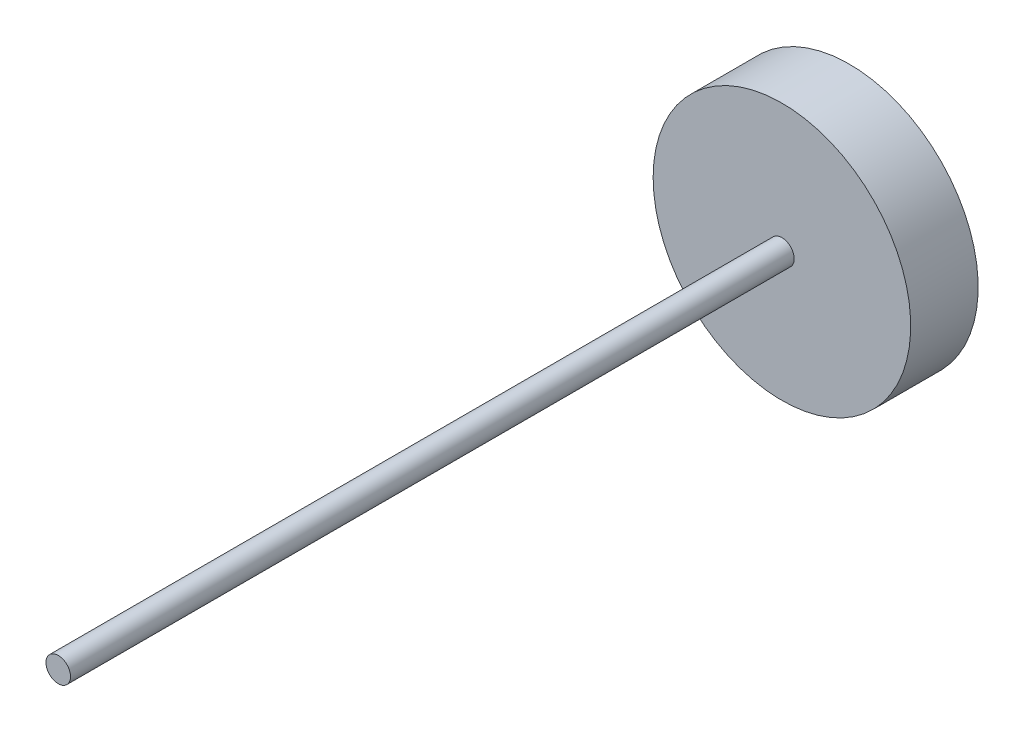
from build123d import *

# Parameters (mm, degrees)
SKETCH1_R                = 88
BOSS_EXTRUDE3_DEPTH      = 25
SKETCH4_W                = 10.4719
SKETCH4_H                = 13.351164338
BOSS_EXTRUDE4_DEPTH      = 25
FILLET2_R                = 4
CIRPATTERN1_COUNT        = 30
FILLET2_OF_CIRPATTERN1_R = 4
SKETCH6_R                = 10
BOSS_EXTRUDE5_DEPTH      = 60
BOSS_EXTRUDE6_START      = 10
SKETCH7_R                = 10
BOSS_EXTRUDE6_DEPTH      = 10
SKETCH8_R                = 10
BOSS_EXTRUDE7_DEPTH      = 10
SKETCH9_R                = 10
BOSS_EXTRUDE8_DEPTH      = 25
SKETCH10_R               = 10
BOSS_EXTRUDE9_DEPTH      = 42.5
SKETCH12_R               = 12.5
CUT_EXTRUDE1_DEPTH       = 12
CUT_EXTRUDE2_START       = -55.5
SKETCH13_R               = 10
CUT_EXTRUDE2_DEPTH       = 55.5
SKETCH14_R               = 10
BOSS_EXTRUDE10_DEPTH     = 440
SKETCH15_R               = 105
BOSS_EXTRUDE12_DEPTH     = 25
BOSS_EXTRUDE13_START     = 30
SKETCH16_R               = 105
BOSS_EXTRUDE13_DEPTH     = 30
SKETCH17_R               = 10
BOSS_EXTRUDE14_DEPTH     = 50
SKETCH18_R               = 10
BOSS_EXTRUDE15_DEPTH     = 30


with BuildPart() as part:
    # Sketch1 → Boss-Extrude3 (new body)
    with BuildSketch(Plane.XY):
        Circle(SKETCH1_R)
    extrude(amount=BOSS_EXTRUDE3_DEPTH)

    # Sketch4 → Boss-Extrude4 (add)
    with BuildSketch(Plane.XY.offset(25)):
        with Locations((0, 93.324417831)):
            Rectangle(SKETCH4_W, SKETCH4_H)
    boss_extrude4 = extrude(amount=-BOSS_EXTRUDE4_DEPTH)

    # Fillet2
    fillet2_edges = [part.edges().sort_by_distance(p)[0] for p in [
        (5.23595, 100, 12.5),
        (0, 100, 0),
        (-5.23595, 100, 12.5),
        (0, 100, 25),
    ]]
    fillet(fillet2_edges, radius=FILLET2_R)

    # CirPattern1: Boss-Extrude4 ×30 about axis
    cirpattern1_axis = Axis((0, 0.317667884, 0), (0, 0, 1))
    for i in range(1, CIRPATTERN1_COUNT):
        add(boss_extrude4.rotate(cirpattern1_axis, i * 360 / CIRPATTERN1_COUNT))

    # Fillet2 of CirPattern1
    fillet2_of_cirpattern1_edges = [part.edges().sort_by_distance(p)[0] for p in [
        (-15.603590285, 98.910317096, 12.5),
        (-20.725122215, 97.821701879, 0),
        (-25.846654145, 96.733086661, 12.5),
        (-20.725122215, 97.821701879, 25),
        (-35.7611788, 93.511662322, 12.5),
        (-40.544457139, 91.382009596, 0),
        (-45.327735478, 89.252356869, 12.5),
        (-40.544457139, 91.382009596, 25),
        (-54.3558322, 84.039982796, 12.5),
        (-58.591804732, 80.962368605, 0),
        (-62.827777264, 77.884754413, 12.5),
        (-58.591804732, 80.962368605, 25),
        (-70.574874905, 70.909236365, 12.5),
        (-74.078409304, 67.018167216, 0),
        (-77.581943702, 63.127098067, 12.5),
        (-74.078409304, 67.018167216, 25),
        (-83.709456921, 54.693299655, 12.5),
        (-86.327431921, 50.158833942, 0),
        (-88.945406921, 45.624368229, 12.5),
        (-86.327431921, 50.158833942, 25),
        (-93.185533987, 36.100886913, 12.5),
        (-94.803531519, 31.121202547, 0),
        (-96.42152905, 26.14151818, 12.5),
        (-94.803531519, 31.121202547, 25),
        (-98.588956064, 15.944575793, 12.5),
        (-99.136261871, 10.737308875, 0),
        (-99.683567678, 5.530041957, 12.5),
        (-99.136261871, 10.737308875, 25),
        (-99.683567678, -4.894706189, 12.5),
        (-99.136261871, -10.101973107, 0),
        (-98.588956064, -15.309240025, 12.5),
        (-99.136261871, -10.101973107, 25),
        (-96.42152905, -25.506182413, 12.5),
        (-94.803531519, -30.485866779, 0),
        (-93.185533987, -35.465551145, 12.5),
        (-94.803531519, -30.485866779, 25),
        (-88.945406921, -44.989032461, 12.5),
        (-86.327431921, -49.523498174, 0),
        (-83.709456921, -54.057963887, 12.5),
        (-86.327431921, -49.523498174, 25),
        (-77.581943702, -62.491762299, 12.5),
        (-74.078409304, -66.382831448, 0),
        (-70.574874905, -70.273900597, 12.5),
        (-74.078409304, -66.382831448, 25),
        (-62.827777264, -77.249418645, 12.5),
        (-58.591804732, -80.327032837, 0),
        (-54.3558322, -83.404647029, 12.5),
        (-58.591804732, -80.327032837, 25),
        (-45.327735478, -88.617021102, 12.5),
        (-40.544457139, -90.746673828, 0),
        (-35.7611788, -92.876326554, 12.5),
        (-40.544457139, -90.746673828, 25),
        (-25.846654145, -96.097750894, 12.5),
        (-20.725122215, -97.186366111, 0),
        (-15.603590285, -98.274981329, 12.5),
        (-20.725122215, -97.186366111, 25),
        (-5.23595, -99.364664232, 12.5),
        (0, -99.364664232, 0),
        (5.23595, -99.364664232, 12.5),
        (0, -99.364664232, 25),
        (15.603590285, -98.274981329, 12.5),
        (20.725122215, -97.186366111, 0),
        (25.846654145, -96.097750894, 12.5),
        (20.725122215, -97.186366111, 25),
        (35.7611788, -92.876326554, 12.5),
        (40.544457139, -90.746673828, 0),
        (45.327735478, -88.617021102, 12.5),
        (40.544457139, -90.746673828, 25),
        (54.3558322, -83.404647029, 12.5),
        (58.591804732, -80.327032837, 0),
        (62.827777264, -77.249418645, 12.5),
        (58.591804732, -80.327032837, 25),
        (70.574874905, -70.273900597, 12.5),
        (74.078409304, -66.382831448, 0),
        (77.581943702, -62.491762299, 12.5),
        (74.078409304, -66.382831448, 25),
        (83.709456921, -54.057963887, 12.5),
        (86.327431921, -49.523498174, 0),
        (88.945406921, -44.989032461, 12.5),
        (86.327431921, -49.523498174, 25),
        (93.185533987, -35.465551145, 12.5),
        (94.803531519, -30.485866779, 0),
        (96.42152905, -25.506182413, 12.5),
        (94.803531519, -30.485866779, 25),
        (98.588956064, -15.309240025, 12.5),
        (99.136261871, -10.101973107, 0),
        (99.683567678, -4.894706189, 12.5),
        (99.136261871, -10.101973107, 25),
        (99.683567678, 5.530041957, 12.5),
        (99.136261871, 10.737308875, 0),
        (98.588956064, 15.944575793, 12.5),
        (99.136261871, 10.737308875, 25),
        (96.42152905, 26.14151818, 12.5),
        (94.803531519, 31.121202547, 0),
        (93.185533987, 36.100886913, 12.5),
        (94.803531519, 31.121202547, 25),
        (88.945406921, 45.624368229, 12.5),
        (86.327431921, 50.158833942, 0),
        (83.709456921, 54.693299655, 12.5),
        (86.327431921, 50.158833942, 25),
        (77.581943702, 63.127098067, 12.5),
        (74.078409304, 67.018167216, 0),
        (70.574874905, 70.909236365, 12.5),
        (74.078409304, 67.018167216, 25),
        (62.827777264, 77.884754413, 12.5),
        (58.591804732, 80.962368605, 0),
        (54.3558322, 84.039982796, 12.5),
        (58.591804732, 80.962368605, 25),
        (45.327735478, 89.252356869, 12.5),
        (40.544457139, 91.382009596, 0),
        (35.7611788, 93.511662322, 12.5),
        (40.544457139, 91.382009596, 25),
        (25.846654145, 96.733086661, 12.5),
        (20.725122215, 97.821701879, 0),
        (15.603590285, 98.910317096, 12.5),
        (20.725122215, 97.821701879, 25),
    ]]
    fillet(fillet2_of_cirpattern1_edges, radius=FILLET2_OF_CIRPATTERN1_R)

    # Sketch6 → Boss-Extrude5 (add)
    with BuildSketch(Plane.XY.offset(25)):
        Circle(SKETCH6_R)
    extrude(amount=BOSS_EXTRUDE5_DEPTH)

    # Sketch7 → Boss-Extrude6 (add)
    with BuildSketch(Plane(origin=(0, 0, 0), x_dir=(-1, 0, 0), z_dir=(0, 0, -1)).offset(BOSS_EXTRUDE6_START)):
        with Locations(Location((0, 0, 0), (0, 0, 180))):
            Circle(SKETCH7_R)
    extrude(amount=-BOSS_EXTRUDE6_DEPTH)

    # Sketch8 → Boss-Extrude7 (add)
    with BuildSketch(Plane.XY.offset(85)):
        Circle(SKETCH8_R)
    extrude(amount=BOSS_EXTRUDE7_DEPTH)

    # Sketch9 → Boss-Extrude8 (add)
    with BuildSketch(Plane.XY.offset(95)):
        Circle(SKETCH9_R)
    extrude(amount=BOSS_EXTRUDE8_DEPTH)

    # Sketch10 → Boss-Extrude9 (add)
    with BuildSketch(Plane.XY.offset(120)):
        Circle(SKETCH10_R)
    extrude(amount=BOSS_EXTRUDE9_DEPTH)

    # Sketch12 → Cut-Extrude1 (cut)
    with BuildSketch(Plane.XY.offset(162.5)):
        Circle(SKETCH12_R)
    extrude(amount=-CUT_EXTRUDE1_DEPTH, mode=Mode.SUBTRACT)

    # Sketch13 → Cut-Extrude2 (cut)
    with BuildSketch(Plane.XY.offset(150.5).offset(CUT_EXTRUDE2_START)):
        Circle(SKETCH13_R)
    extrude(amount=CUT_EXTRUDE2_DEPTH, mode=Mode.SUBTRACT)

    # Sketch14 → Boss-Extrude10 (add)
    with BuildSketch(Plane.XY.offset(95)):
        Circle(SKETCH14_R)
    extrude(amount=BOSS_EXTRUDE10_DEPTH)

    # Sketch15 → Boss-Extrude12 (add)
    with BuildSketch(Plane(origin=(0, 0, 0), x_dir=(-1, 0, 0), z_dir=(0, 0, -1))):
        Circle(SKETCH15_R)
    extrude(amount=-BOSS_EXTRUDE12_DEPTH)

    # Sketch16 → Boss-Extrude13 (add)
    with BuildSketch(Plane(origin=(0, 0, 0), x_dir=(-1, 0, 0), z_dir=(0, 0, -1)).offset(BOSS_EXTRUDE13_START)):
        Circle(SKETCH16_R)
    extrude(amount=-BOSS_EXTRUDE13_DEPTH)

    # Sketch17 → Boss-Extrude14 (add)
    with BuildSketch(Plane.XY.offset(535)):
        Circle(SKETCH17_R)
    extrude(amount=BOSS_EXTRUDE14_DEPTH)

    # Sketch18 → Boss-Extrude15 (add)
    with BuildSketch(Plane.XY.offset(585)):
        Circle(SKETCH18_R)
    extrude(amount=BOSS_EXTRUDE15_DEPTH)


solid = part.part
